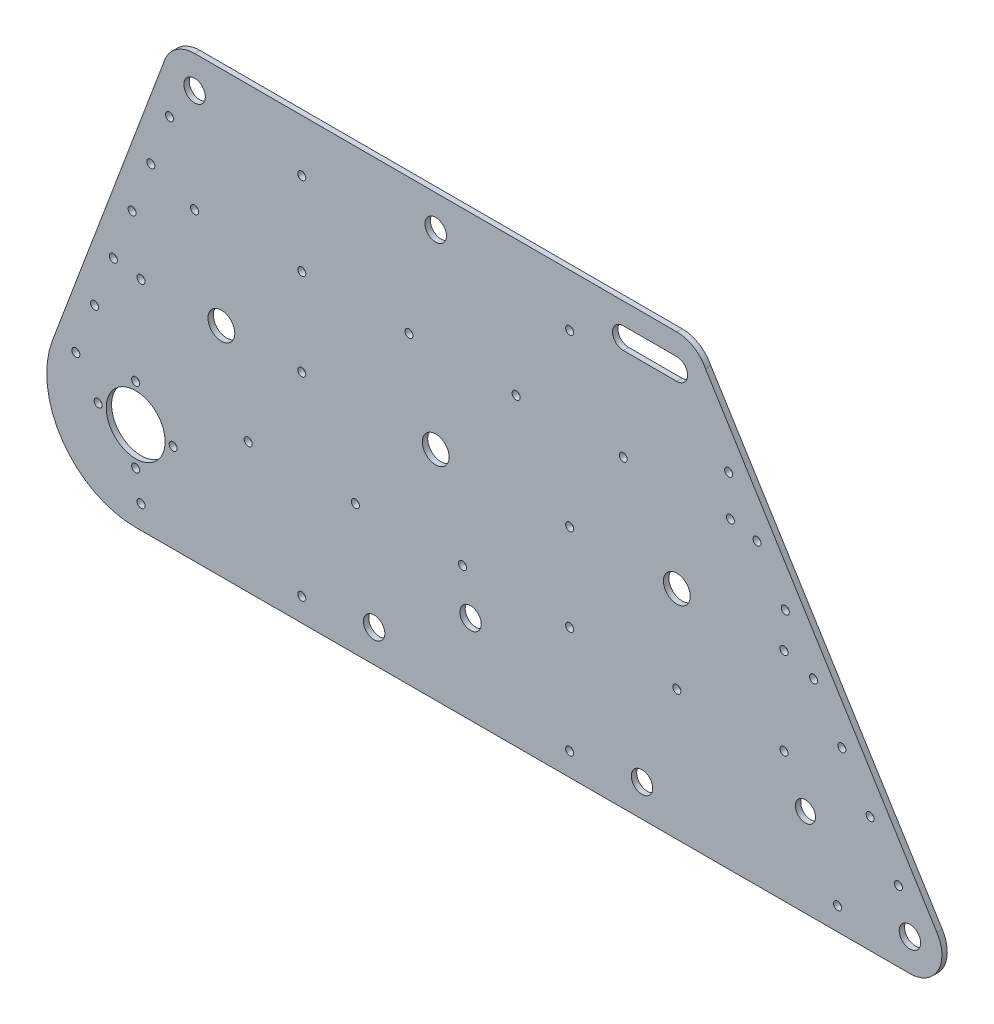
from build123d import *

# Parameters (mm, degrees)
SKETCH2_R           = 3.9998
SKETCH2_R_2         = 1.499925
SKETCH2_R_3         = 4.99975
SKETCH2_R_4         = 3.7498125
SKETCH2_R_5         = 1.5
SKETCH2_R_6         = 10.99945
BOSS_EXTRUDE1_DEPTH = 2


with BuildPart() as part:
    # Sketch2 → Boss-Extrude1 (new body)
    with BuildSketch(Plane.XY):
        with BuildLine():
            Line((96.362607148, 83.91244893), (182.746139217, -55.124360407))
            ThreePointArc((182.746139217, -55.124360407), (183.120738534, -67.267781048), (172.665833933, -73.456315551))
            Line((172.665833933, -73.456315551), (-116.301106221, -73.709344442))
            ThreePointArc((-116.301106221, -73.709344442), (-143.610306979, -59.428306601), (-147.408355202, -28.84538134))
            Line((-147.408355202, -28.84538134), (-105.239440592, 83.486872373))
            ThreePointArc((-105.239440592, 83.486872373), (-100.811651195, 88.586021375), (-94.331273913, 90.486376541))
            Line((-94.331273913, 90.486376541), (85.638662445, 90.486376541))
            ThreePointArc((85.638662445, 90.486376541), (91.93104468, 88.717175744), (96.362607148, 83.91244893))
        make_face()
        with Locations((-94.331273913, 78.486872372)):
            Circle(SKETCH2_R, mode=Mode.SUBTRACT)
        with Locations((-4.335773913, 78.486872372)):
            Circle(SKETCH2_R, mode=Mode.SUBTRACT)
        with Locations((-54.333273913, 70.986872372)):
            Circle(SKETCH2_R_2, mode=Mode.SUBTRACT)
        with Locations((-103.671855402, 65.368244598)):
            Circle(SKETCH2_R_2, mode=Mode.SUBTRACT)
        with Locations((-110.669996254, 46.632415776)):
            Circle(SKETCH2_R_2, mode=Mode.SUBTRACT)
        with Locations((-94.331273913, 39.98689418)):
            Circle(SKETCH2_R_2, mode=Mode.SUBTRACT)
        with Locations((-117.667881298, 27.897271817)):
            Circle(SKETCH2_R_2, mode=Mode.SUBTRACT)
        with Locations((-114.330273913, 7.486872372)):
            Circle(SKETCH2_R_2, mode=Mode.SUBTRACT)
        with Locations((-124.665791603, 9.162060229)):
            Circle(SKETCH2_R_2, mode=Mode.SUBTRACT)
        with Locations((-131.663765383, -9.573321299)):
            Circle(SKETCH2_R_2, mode=Mode.SUBTRACT)
        with Locations((-116.330173913, -26.513127628)):
            Circle(SKETCH2_R_2, mode=Mode.SUBTRACT)
        with Locations((-138.661805034, -28.308879181)):
            Circle(SKETCH2_R_2, mode=Mode.SUBTRACT)
        with Locations((-130.329473913, -40.513127628)):
            Circle(SKETCH2_R_2, mode=Mode.SUBTRACT)
        with Locations((-102.330873913, -40.513127628)):
            Circle(SKETCH2_R_2, mode=Mode.SUBTRACT)
        with Locations((-114.330273913, -65.013127628)):
            Circle(SKETCH2_R_2, mode=Mode.SUBTRACT)
        with Locations((-116.330173913, -54.513127628)):
            Circle(SKETCH2_R_2, mode=Mode.SUBTRACT)
        with Locations((8.663576087, -40.513127628)):
            Circle(SKETCH2_R, mode=Mode.SUBTRACT)
        with Locations((-54.333273913, -65.013127628)):
            Circle(SKETCH2_R_2, mode=Mode.SUBTRACT)
        with Locations((-27.334544722, -61.513127628)):
            Circle(SKETCH2_R, mode=Mode.SUBTRACT)
        with Locations((-74.332273913, -25.013127628)):
            Circle(SKETCH2_R_2, mode=Mode.SUBTRACT)
        with Locations((-84.331773913, 7.486872372)):
            Circle(SKETCH2_R_3, mode=Mode.SUBTRACT)
        with Locations((-54.333273913, 7.486872372)):
            Circle(SKETCH2_R_2, mode=Mode.SUBTRACT)
        with Locations((-34.334273913, -25.013127628)):
            Circle(SKETCH2_R_2, mode=Mode.SUBTRACT)
        with Locations((-54.333273913, 39.986891336)):
            Circle(SKETCH2_R_2, mode=Mode.SUBTRACT)
        with Locations((-14.335273913, 39.986886595)):
            Circle(SKETCH2_R_2, mode=Mode.SUBTRACT)
        with Locations((-4.335773913, 7.486872372)):
            Circle(SKETCH2_R_3, mode=Mode.SUBTRACT)
        with Locations((5.663726087, -25.013127628)):
            Circle(SKETCH2_R_2, mode=Mode.SUBTRACT)
        with Locations((85.659726087, -25.013127628)):
            Circle(SKETCH2_R_2, mode=Mode.SUBTRACT)
        with Locations((45.661726087, -25.013127628)):
            Circle(SKETCH2_R_2, mode=Mode.SUBTRACT)
        with Locations((45.661726087, 7.486872372)):
            Circle(SKETCH2_R_2, mode=Mode.SUBTRACT)
        with Locations((25.662726087, 39.98688375)):
            Circle(SKETCH2_R_2, mode=Mode.SUBTRACT)
        with Locations((45.661726087, 70.986872372)):
            Circle(SKETCH2_R_2, mode=Mode.SUBTRACT)
        with Locations((65.660726087, 39.986879958)):
            Circle(SKETCH2_R_2, mode=Mode.SUBTRACT)
        with Locations((72.660376087, -61.513127628)):
            Circle(SKETCH2_R, mode=Mode.SUBTRACT)
        with Locations((45.661726087, -65.013127628)):
            Circle(SKETCH2_R_2, mode=Mode.SUBTRACT)
        with Locations((125.657726087, -25.013127628)):
            Circle(SKETCH2_R_2, mode=Mode.SUBTRACT)
        with Locations((133.657326087, -40.513127628)):
            Circle(SKETCH2_R_4, mode=Mode.SUBTRACT)
        with Locations((145.656716219, -65.013127628)):
            Circle(SKETCH2_R_2, mode=Mode.SUBTRACT)
        with Locations((172.655376087, -61.513127628)):
            Circle(SKETCH2_R, mode=Mode.SUBTRACT)
        with Locations((168.349885089, -47.111508591)):
            Circle(SKETCH2_R_2, mode=Mode.SUBTRACT)
        with Locations((157.795381517, -30.123727868)):
            Circle(SKETCH2_R_2, mode=Mode.SUBTRACT)
        with Locations((147.240959183, -13.136077902)):
            Circle(SKETCH2_R_2, mode=Mode.SUBTRACT)
        with Locations((136.686149927, 3.852194828)):
            Circle(SKETCH2_R_2, mode=Mode.SUBTRACT)
        with Locations((125.657726087, 7.486872372)):
            Circle(SKETCH2_R_2, mode=Mode.SUBTRACT)
        with Locations((85.659726087, 7.486872372)):
            Circle(SKETCH2_R_3, mode=Mode.SUBTRACT)
        with Locations((126.131439072, 20.840309178)):
            Circle(SKETCH2_R_2, mode=Mode.SUBTRACT)
        with Locations((115.576938019, 37.828085844)):
            Circle(SKETCH2_R_2, mode=Mode.SUBTRACT)
        with Locations((105.658726087, 39.986878061)):
            Circle(SKETCH2_R_5, mode=Mode.SUBTRACT)
        with Locations((105.022596502, 54.815605735)):
            Circle(SKETCH2_R_2, mode=Mode.SUBTRACT)
        with Locations((-116.330173913, -40.513127628)):
            Circle(SKETCH2_R_6, mode=Mode.SUBTRACT)
        with BuildLine():
            Line((65.660726087, 82.486872372), (85.659726087, 82.486872372))
            ThreePointArc((85.659726087, 82.486872372), (89.659726087, 78.486872372), (85.659726087, 74.486872372))
            Line((85.659726087, 74.486872372), (65.660726087, 74.486872372))
            ThreePointArc((65.660726087, 74.486872372), (61.660726087, 78.486872372), (65.660726087, 82.486872372))
        make_face(mode=Mode.SUBTRACT)
    extrude(amount=BOSS_EXTRUDE1_DEPTH)


solid = part.part
